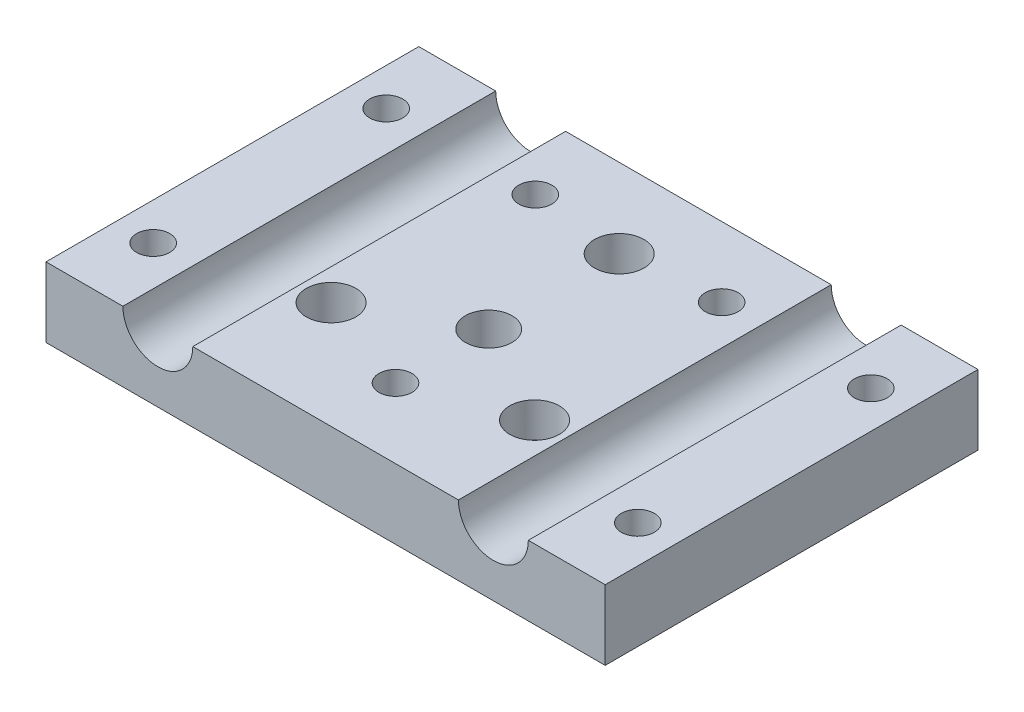
from build123d import *

# Parameters (mm, degrees)
SKETCH1_W               = 76.2
SKETCH1_H               = 50.8
BOSS_EXTRUDE1_DEPTH     = 9.525
F_1_4_CLEARANCE_HOLE1_D = 6.7564
CUT_EXTRUDE1_DEPTH      = 65.210401221
SKETCH5_R               = 2.38125
CUT_EXTRUDE2_DEPTH      = 47.770670564
F_8_CLEARANCE_HOLE1_D   = 4.4958
CUT_EXTRUDE3_DEPTH      = 4.7625
CUT_EXTRUDE4_DEPTH      = 3.175
SKETCH11_R              = 3.175
CUT_EXTRUDE5_DEPTH      = 6.35


with BuildPart() as part:
    # Sketch1 → Boss-Extrude1 (new body)
    with BuildSketch(Plane(origin=(0, 0, 0), x_dir=(1, 0, 0), z_dir=(0, 1, 0))):
        Rectangle(SKETCH1_W, SKETCH1_H)
    extrude(amount=BOSS_EXTRUDE1_DEPTH)

    # 1/4 Clearance Hole1 (through all)
    with Locations(Plane(origin=(0, 9.525, 0), x_dir=(1, 0, 0), z_dir=(0, 1, 0))):
        with Locations((0, 14.61008), (-13.86078, -10.78992), (13.86078, -10.78992)):
            Hole(F_1_4_CLEARANCE_HOLE1_D / 2)

    # Sketch4 → Cut-Extrude1 (cut, through all)
    with BuildSketch(Plane.XY.offset(25.4)):
        with BuildLine():
            Line((-27.6225, 9.525), (-18.0975, 9.525))
            ThreePointArc((-18.0975, 9.525), (-22.86, 4.7625), (-27.6225, 9.525))
        make_face()
        with BuildLine():
            Line((18.0975, 9.525), (27.6225, 9.525))
            ThreePointArc((27.6225, 9.525), (22.86, 4.7625), (18.0975, 9.525))
        make_face()
    extrude(amount=-CUT_EXTRUDE1_DEPTH, mode=Mode.SUBTRACT)

    # Sketch5 → Cut-Extrude2 (cut, through all)
    with BuildSketch(Plane(origin=(0, 9.525, 0), x_dir=(1, 0, 0), z_dir=(0, 1, 0))):
        with Locations(Location((0, -3.175, 0), (0, 0, 270))):
            Circle(SKETCH5_R)
    extrude(amount=-CUT_EXTRUDE2_DEPTH, mode=Mode.SUBTRACT)

    # #8 Clearance Hole1 (through all)
    with Locations(Plane(origin=(0, 9.525, 0), x_dir=(1, 0, 0), z_dir=(0, 1, 0))):
        with Locations((-33.02, 15.875), (-33.02, -15.875), (33.02, -15.875), (33.02, 15.875), (-12.7, 15.875), (12.7, 15.875), (0, -15.875)):
            Hole(F_8_CLEARANCE_HOLE1_D / 2)

    # Sketch8 → Cut-Extrude3 (cut)
    with BuildSketch(Plane.XZ):
        Polygon((-17.28978, 4.82092), (-10.43178, 4.82092), (-7.00278, 10.760122219), (-10.43178, 16.699324438), (-17.28978, 16.699324438), (-20.71878, 10.760122219), align=None)
        Polygon((10.43178, 4.82092), (17.28978, 4.82092), (20.71878, 10.760122219), (17.28978, 16.699324438), (10.43178, 16.699324438), (7.00278, 10.760122219), align=None)
        Polygon((-3.429, -20.57908), (3.429, -20.57908), (6.858, -14.639877781), (3.429, -8.700675562), (-3.429, -8.700675562), (-6.858, -14.639877781), align=None)
    extrude(amount=-CUT_EXTRUDE3_DEPTH, mode=Mode.SUBTRACT)

    # Sketch9 → Cut-Extrude4 (cut)
    with BuildSketch(Plane.XZ):
        Polygon((-37.465, 13.308678053), (-37.465, 18.441321947), (-33.02, 21.007643893), (-28.575, 18.441321947), (-28.575, 13.308678053), (-33.02, 10.742356107), align=None)
        Polygon((-4.445, 13.308678053), (-4.445, 18.441321947), (0, 21.007643893), (4.445, 18.441321947), (4.445, 13.308678053), (0, 10.742356107), align=None)
        Polygon((28.575, 13.308678053), (28.575, 18.441321947), (33.02, 21.007643893), (37.465, 18.441321947), (37.465, 13.308678053), (33.02, 10.742356107), align=None)
        Polygon((28.575, -18.441321947), (28.575, -13.308678053), (33.02, -10.742356107), (37.465, -13.308678053), (37.465, -18.441321947), (33.02, -21.007643893), align=None)
        Polygon((8.255, -18.441321947), (8.255, -13.308678053), (12.7, -10.742356107), (17.145, -13.308678053), (17.145, -18.441321947), (12.7, -21.007643893), align=None)
        Polygon((-17.145, -18.441321947), (-17.145, -13.308678053), (-12.7, -10.742356107), (-8.255, -13.308678053), (-8.255, -18.441321947), (-12.7, -21.007643893), align=None)
        Polygon((-37.465, -18.441321947), (-37.465, -13.308678053), (-33.02, -10.742356107), (-28.575, -13.308678053), (-28.575, -18.441321947), (-33.02, -21.007643893), align=None)
    extrude(amount=-CUT_EXTRUDE4_DEPTH, mode=Mode.SUBTRACT)

    # Sketch11 → Cut-Extrude5 (cut)
    with BuildSketch(Plane(origin=(0, 9.525, 0), x_dir=(1, 0, 0), z_dir=(0, 1, 0))):
        with Locations(Location((0, -3.175, 0), (0, 0, 270))):
            Circle(SKETCH11_R)
    extrude(amount=-CUT_EXTRUDE5_DEPTH, mode=Mode.SUBTRACT)


solid = part.part
